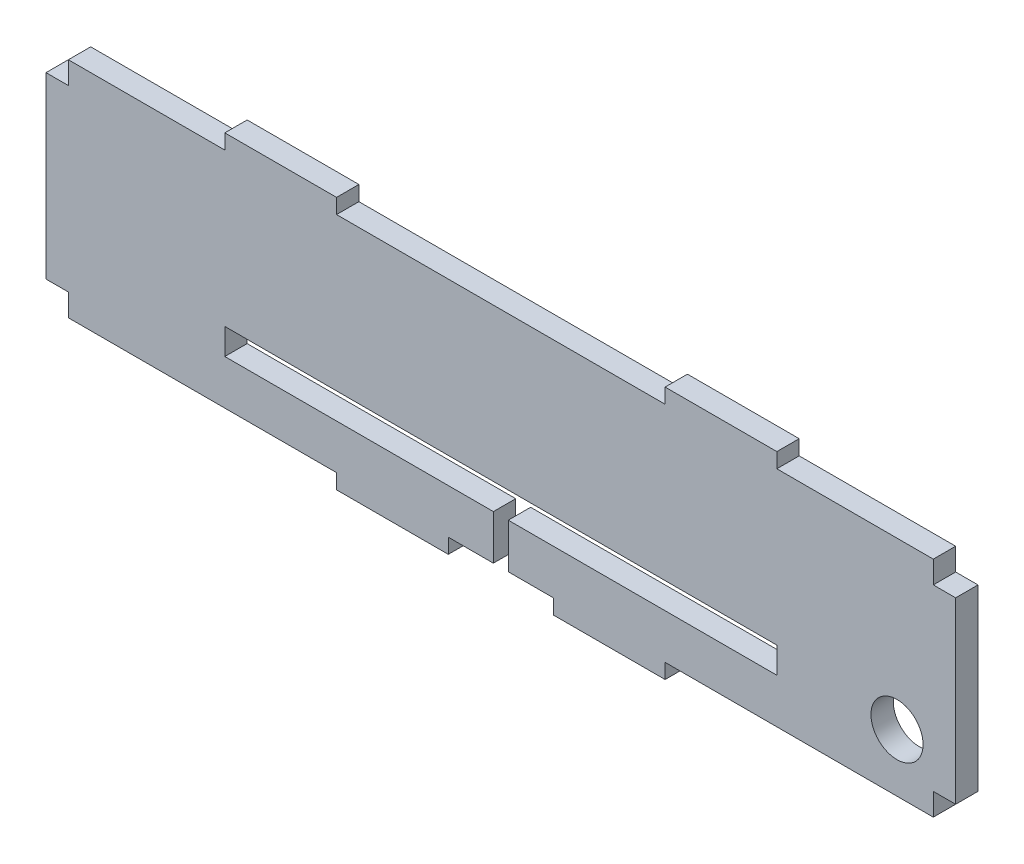
from build123d import *

# Parameters (mm, degrees)
SKETCH1_R           = 3.5
BOSS_EXTRUDE3_DEPTH = 3


with BuildPart() as part:
    # Sketch1 → Boss-Extrude3 (new body)
    with BuildSketch(Plane.XY):
        Polygon((6, 3), (6, 0), (42, 0), (42, -2), (57, -2), (57, 0), (63.05, 0), (63.05, 6), (27, 6), (27, 9.5), (101.1, 9.5), (101.1, 6), (65.05, 6), (65.05, 0), (71.1, 0), (71.1, -2), (86.1, -2), (86.1, 0), (122.1, 0), (122.1, 3), (125.1, 3), (125.1, 27), (122.1, 27), (122.1, 30), (101.1, 30), (101.1, 32), (86.1, 32), (86.1, 30), (42, 30), (42, 32), (27, 32), (27, 30), (6, 30), (6, 27), (3, 27), (3, 3), align=None)
        with Locations((117.228803839, 7.75)):
            Circle(SKETCH1_R, mode=Mode.SUBTRACT)
    extrude(amount=BOSS_EXTRUDE3_DEPTH)


solid = part.part
